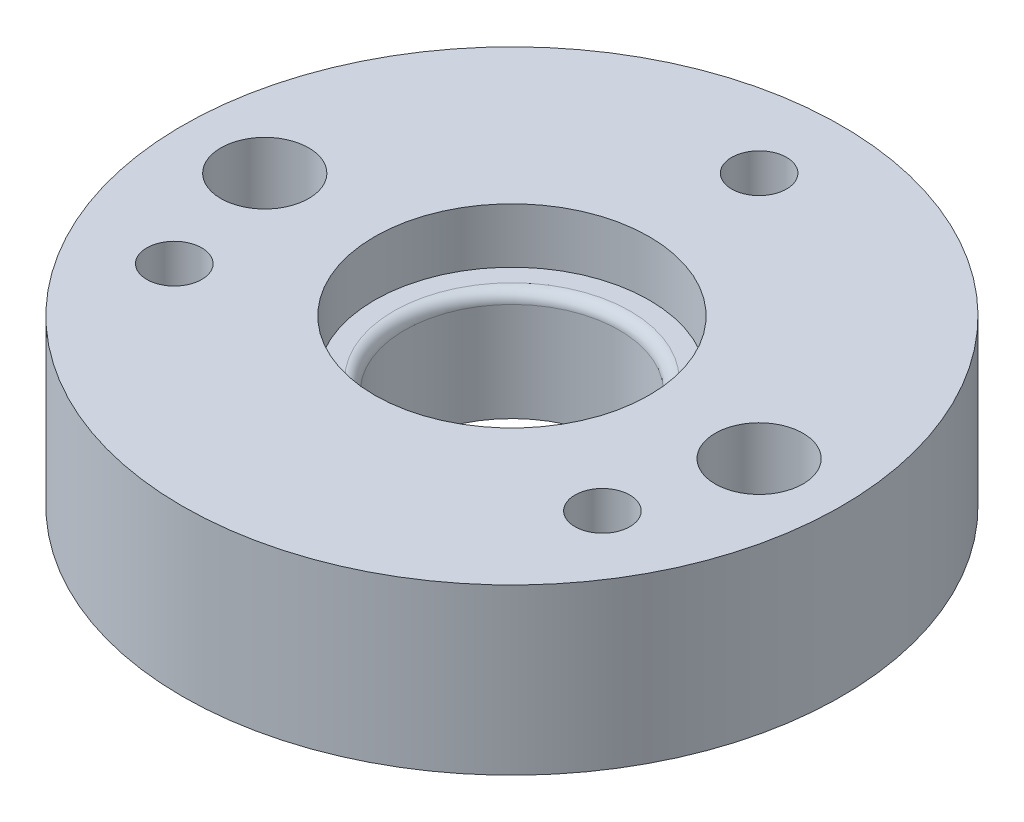
from build123d import *

# Parameters (mm, degrees)
SKETCH1_R             = 30
BOSS_EXTRUDE1_DEPTH   = 15
CUT_EXTRUDE1_REACH    = 47
SKETCH2_R             = 9.765
SKETCH3_R             = 12.5
CUT_EXTRUDE2_DEPTH    = 5
FILLET1_R             = 1
M6_TAPPED_HOLE1_D     = 5
M6_TAPPED_HOLE1_DEPTH = 17
M6_TAPPED_HOLE1_TIP   = 1.502151548
F_8_0MM_DOWEL_HOLE1_D = 8


with BuildPart() as part:
    # Sketch1 → Boss-Extrude1 (new body)
    with BuildSketch(Plane(origin=(0, 0, 0), x_dir=(1, 0, 0), z_dir=(0, 1, 0))):
        with Locations(Location((0, 0, 0), (0, 0, 270))):
            Circle(SKETCH1_R)
    extrude(amount=BOSS_EXTRUDE1_DEPTH)

    # Sketch2 → Cut-Extrude1 (cut, up to next)
    with BuildSketch(Plane(origin=(0, 15, 0), x_dir=(1, 0, 0), z_dir=(0, 1, 0)), mode=Mode.PRIVATE) as cut_extrude1_sk1:
        with Locations(Location((0, 0, 0), (0, 0, 270))):
            Circle(SKETCH2_R)
    cut_extrude1_tool1 = extrude(cut_extrude1_sk1.sketch, amount=-CUT_EXTRUDE1_REACH, mode=Mode.PRIVATE) & part.part
    add(cut_extrude1_tool1.solids().sort_by_distance((0, 15, 0))[0], mode=Mode.SUBTRACT)

    # Sketch3 → Cut-Extrude2 (cut)
    with BuildSketch(Plane(origin=(0, 15, 0), x_dir=(1, 0, 0), z_dir=(0, 1, 0))):
        with Locations(Location((0, 0, 0), (0, 0, 270))):
            Circle(SKETCH3_R)
    extrude(amount=-CUT_EXTRUDE2_DEPTH, mode=Mode.SUBTRACT)

    # Fillet1
    fillet1_edges = [part.edges().sort_by_distance(p)[0] for p in [
        (0, 10, -9.765),
    ]]
    fillet(fillet1_edges, radius=FILLET1_R)

    # M6 Tapped Hole1
    with Locations(Plane(origin=(0, 15, 0), x_dir=(1, 0, 0), z_dir=(0, 1, 0))):
        with Locations((0, 22.5), (19.485571585, -11.25), (-19.485571585, -11.25)):
            Hole(M6_TAPPED_HOLE1_D / 2, depth=M6_TAPPED_HOLE1_DEPTH)
            with Locations((0, 0, -(M6_TAPPED_HOLE1_DEPTH + M6_TAPPED_HOLE1_TIP / 2))):  # 118° drill point
                Cone(0, M6_TAPPED_HOLE1_D / 2, M6_TAPPED_HOLE1_TIP, mode=Mode.SUBTRACT)

    # Ø8.0mm Dowel Hole1 (through all)
    with Locations(Plane(origin=(0, 15, 0), x_dir=(1, 0, 0), z_dir=(0, 1, 0))):
        with Locations((22.5, 0), (-22.5, 0)):
            Hole(F_8_0MM_DOWEL_HOLE1_D / 2)


solid = part.part
